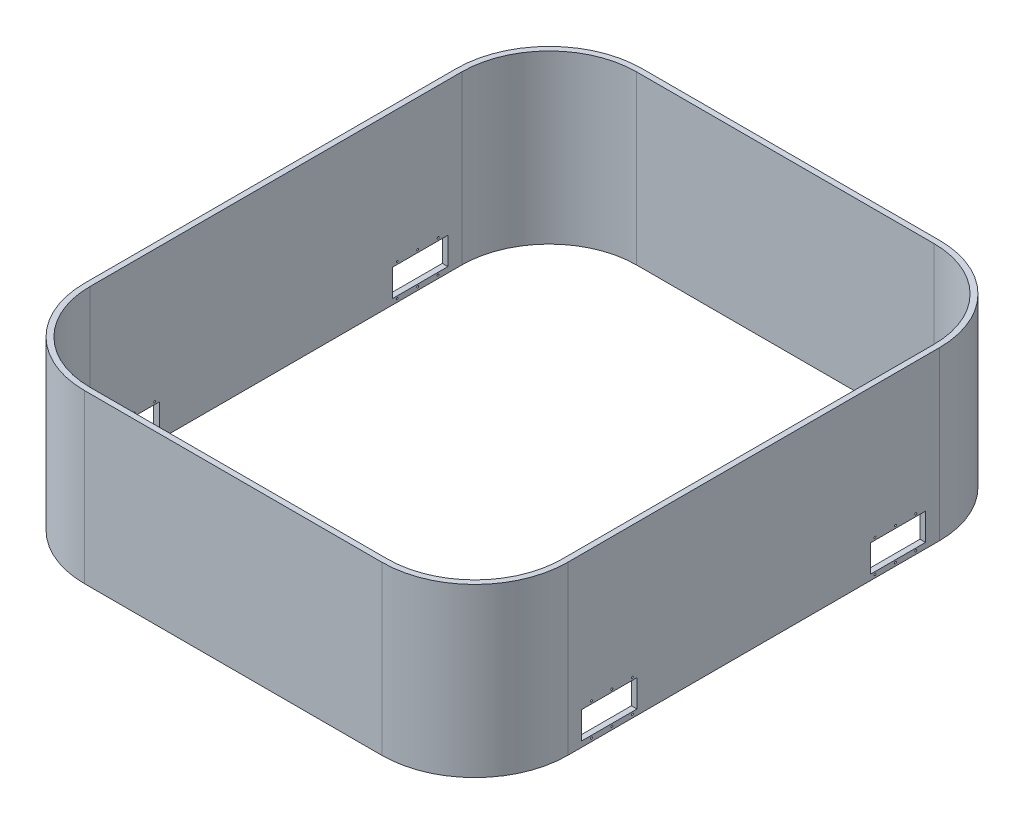
from build123d import *

# Parameters (mm, degrees)
CHAPALATERAL_DEPTH        = 180
MOTORTRASEIRO_DEPTH       = 622.768445645
MOTORTRASEIRO_DEPTH_BACK  = 622.768445645
ESBO_O8_W                 = 59.5
ESBO_O8_H                 = 29.2
MOTORFRONTAL_DEPTH        = 622.768445645
MOTORFRONTAL_DEPTH_BACK   = 622.768445645
ESBO_O10_W                = 59.5
ESBO_O10_H                = 29.2
FUROSDYNAMIXEL_DEPTH      = 627.73758464
FUROSDYNAMIXEL_DEPTH_BACK = 627.73758464
ESBO_O15_R                = 1.025


with BuildPart() as part:
    # Chapa inferior → ChapaLateral (new body)
    with BuildSketch(Plane(origin=(0, 0, 0), x_dir=(1, 0, 0), z_dir=(0, 1, 0))):
        with BuildLine():
            Line((-160, 300), (160, 300))
            ThreePointArc((160, 300), (230.710678119, 270.710678119), (260, 200))
            Line((260, 200), (260, -200))
            ThreePointArc((260, -200), (230.710678119, -270.710678119), (160, -300))
            Line((160, -300), (-160, -300))
            ThreePointArc((-160, -300), (-230.710678119, -270.710678119), (-260, -200))
            Line((-260, -200), (-260, 200))
            ThreePointArc((-260, 200), (-230.710678119, 270.710678119), (-160, 300))
        make_face()
        with BuildLine():
            Line((-160, 294), (160, 294))
            ThreePointArc((160, 294), (226.468037432, 266.468037432), (254, 200))
            Line((254, 200), (254, -200))
            ThreePointArc((254, -200), (226.468037432, -266.468037432), (160, -294))
            Line((160, -294), (-160, -294))
            ThreePointArc((-160, -294), (-226.468037432, -266.468037432), (-254, -200))
            Line((-254, -200), (-254, 200))
            ThreePointArc((-254, 200), (-226.468037432, 266.468037432), (-160, 294))
        make_face(mode=Mode.SUBTRACT)
    extrude(amount=CHAPALATERAL_DEPTH)

    # Esboço8 → MotorTraseiro (cut, two sides: drawn at the far end of the back side and taken through both)
    with BuildSketch(Plane.ZY.offset(-254).offset(-MOTORTRASEIRO_DEPTH_BACK)):
        with Locations((-155.25, 20.6)):
            Rectangle(ESBO_O8_W, ESBO_O8_H)
    extrude(amount=MOTORTRASEIRO_DEPTH + MOTORTRASEIRO_DEPTH_BACK, mode=Mode.SUBTRACT)

    # Esboço10 → MotorFrontal (cut, two sides: drawn at the far end of the back side and taken through both)
    with BuildSketch(Plane.ZY.offset(-254).offset(-MOTORFRONTAL_DEPTH_BACK)):
        with Locations((155.25, 20.6)):
            Rectangle(ESBO_O10_W, ESBO_O10_H)
    extrude(amount=MOTORFRONTAL_DEPTH + MOTORFRONTAL_DEPTH_BACK, mode=Mode.SUBTRACT)

    # Esboço15 → FurosDynamixel (cut, two sides: drawn at the far end of the back side and taken through both)
    with BuildSketch(Plane.ZY.offset(260).offset(-FUROSDYNAMIXEL_DEPTH_BACK)):
        with Locations((174.5, 38)):
            Circle(ESBO_O15_R)
        with Locations((152.5, 38)):
            Circle(ESBO_O15_R)
        with Locations((130.5, 38)):
            Circle(ESBO_O15_R)
        with Locations((152.5, 3.4)):
            Circle(ESBO_O15_R)
        with Locations((130.5, 3.4)):
            Circle(ESBO_O15_R)
        with Locations((174.5, 3.4)):
            Circle(ESBO_O15_R)
        with Locations((-174.5, 3.4)):
            Circle(ESBO_O15_R)
        with Locations((-130.5, 3.4)):
            Circle(ESBO_O15_R)
        with Locations((-152.5, 3.4)):
            Circle(ESBO_O15_R)
        with Locations((-130.5, 38)):
            Circle(ESBO_O15_R)
        with Locations((-152.5, 38)):
            Circle(ESBO_O15_R)
        with Locations((-174.5, 38)):
            Circle(ESBO_O15_R)
    extrude(amount=FUROSDYNAMIXEL_DEPTH + FUROSDYNAMIXEL_DEPTH_BACK, mode=Mode.SUBTRACT)


solid = part.part
